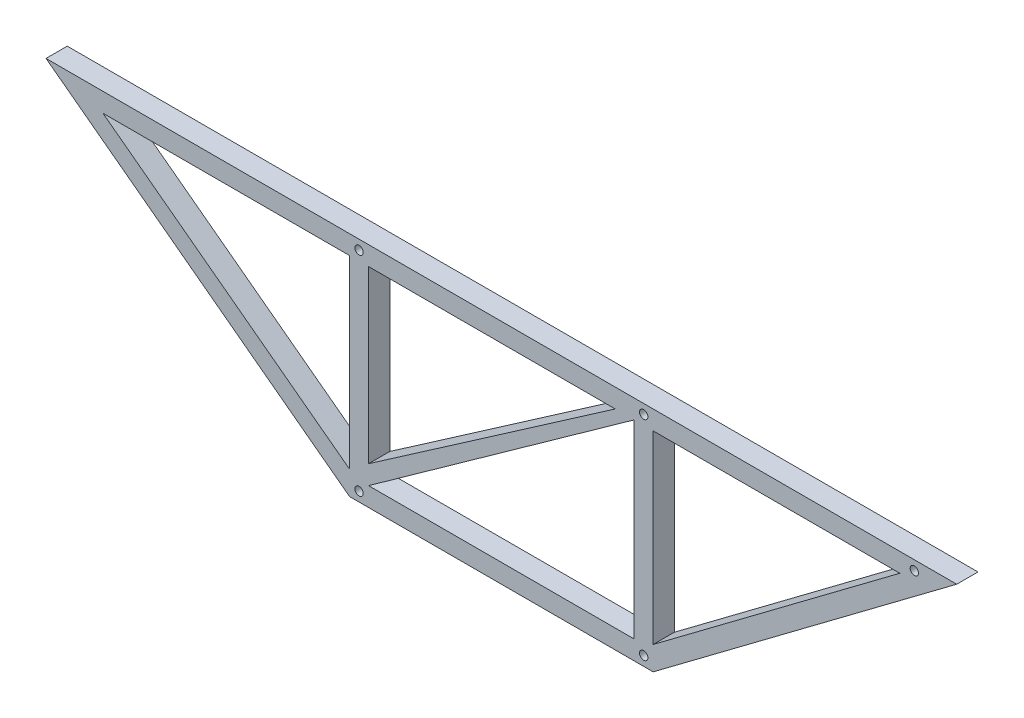
from build123d import *

# Parameters (mm, degrees)
BOSS_EXTRUDE1_DEPTH = 14
CUT_EXTRUDE1_DEPTH  = 28
CUT_EXTRUDE2_DEPTH  = 28
CUT_EXTRUDE3_DEPTH  = 28
SKETCH5_R           = 5.5
CUT_EXTRUDE4_DEPTH  = 28


with BuildPart() as part:
    # Sketch1 → Boss-Extrude1 (new, symmetric)
    with BuildSketch(Plane.XY):
        Polygon((-600, 0), (600, 0), (200, -300), (-200, -300), align=None)
    extrude(amount=BOSS_EXTRUDE1_DEPTH, both=True)

    # Sketch2 → Cut-Extrude1 (cut)
    with BuildSketch(Plane.XY.offset(14)):
        Polygon((-175, -275), (175, -275), (175, -25), align=None)
        Polygon((-175, -25), (-175, -250), (150, -25), align=None)
    extrude(amount=-CUT_EXTRUDE1_DEPTH, mode=Mode.SUBTRACT)

    # Sketch3 → Cut-Extrude2 (cut)
    with BuildSketch(Plane.XY.offset(14)):
        Polygon((-525, -25), (-200, -25), (-200, -268.75), align=None)
    extrude(amount=-CUT_EXTRUDE2_DEPTH, mode=Mode.SUBTRACT)

    # Sketch4 → Cut-Extrude3 (cut)
    with BuildSketch(Plane.XY.offset(14)):
        Polygon((200, -25), (525, -25), (200, -268.75), align=None)
    extrude(amount=-CUT_EXTRUDE3_DEPTH, mode=Mode.SUBTRACT)

    # Sketch5 → Cut-Extrude4 (cut)
    with BuildSketch(Plane.XY.offset(14)):
        with Locations((-187.5, -12.5)):
            Circle(SKETCH5_R)
        with Locations((-187.5, -287.5)):
            Circle(SKETCH5_R)
        with Locations((187.5, -287.5)):
            Circle(SKETCH5_R)
        with Locations((187.5, -12.5)):
            Circle(SKETCH5_R)
        with Locations((544.11011126, -12.5)):
            Circle(SKETCH5_R)
    extrude(amount=-CUT_EXTRUDE4_DEPTH, mode=Mode.SUBTRACT)


solid = part.part
